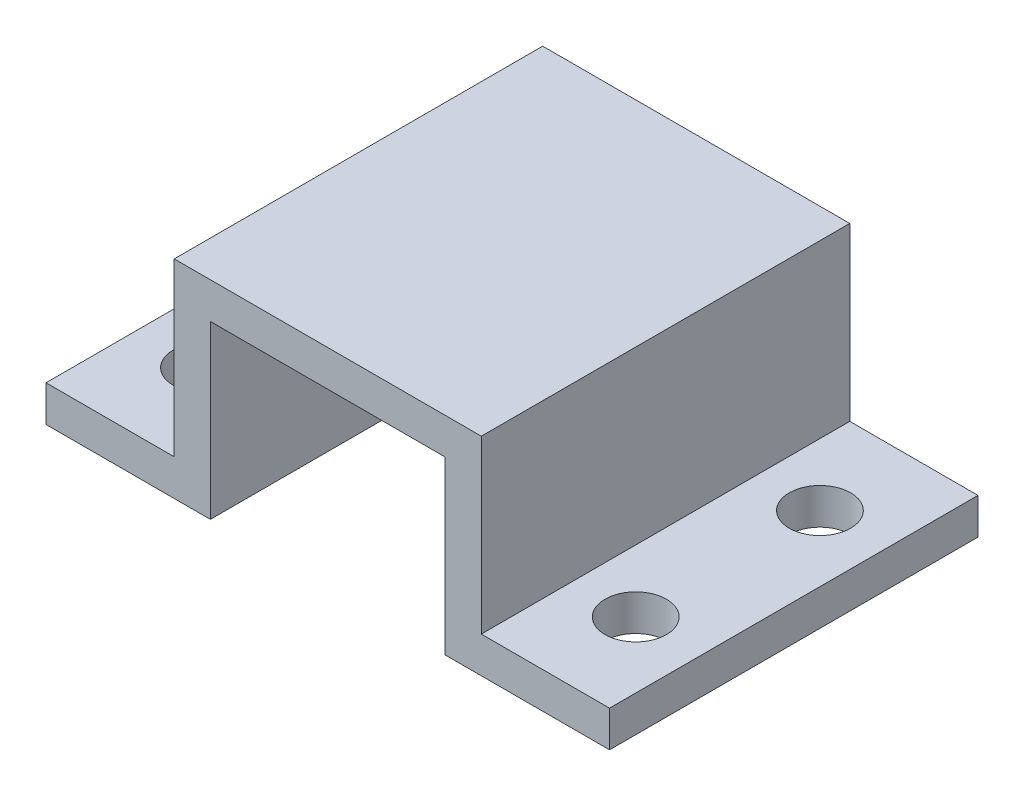
from build123d import *

# Parameters (mm, degrees)
SKETCH1_W             = 9.1
SKETCH1_H             = 20.4
SKETCH1_R             = 1.7
BOSS_EXTRUDE1_DEPTH   = 2
BOSS_EXTRUDE1_2_DEPTH = 2
SKETCH2_W             = 2
SKETCH2_H             = 20.4
BOSS_EXTRUDE2_DEPTH   = 9.49
SKETCH3_W             = 17
SKETCH3_H             = 20.4
BOSS_EXTRUDE3_DEPTH   = 2


with BuildPart() as part:
    # Sketch1 → Boss-Extrude1 (new body)
    with BuildSketch(Plane(origin=(0, 0, 0), x_dir=(1, 0, 0), z_dir=(0, 1, 0))):
        with Locations((-11.05, 0)):
            Rectangle(SKETCH1_W, SKETCH1_H)
        with Locations(Location((-11.95, -5.1, 0), (0, 0, 270))):
            Circle(SKETCH1_R, mode=Mode.SUBTRACT)
        with Locations(Location((-11.95, 5.1, 0), (0, 0, 270))):
            Circle(SKETCH1_R, mode=Mode.SUBTRACT)
    extrude(amount=BOSS_EXTRUDE1_DEPTH)



with BuildPart() as body_2:
    # Sketch1 → Boss-Extrude1 2 (new body)
    with BuildSketch(Plane(origin=(0, 0, 0), x_dir=(1, 0, 0), z_dir=(0, 1, 0))):
        with Locations((11.05, 0)):
            Rectangle(SKETCH1_W, SKETCH1_H)
        with Locations(Location((11.95, -5.1, 0), (0, 0, 270))):
            Circle(SKETCH1_R, mode=Mode.SUBTRACT)
        with Locations(Location((11.95, 5.1, 0), (0, 0, 270))):
            Circle(SKETCH1_R, mode=Mode.SUBTRACT)
    extrude(amount=BOSS_EXTRUDE1_2_DEPTH)


with BuildPart() as part_1:
    add(part.part)

    add(body_2.part)  # Boss-Extrude2 merges body 2
    # Sketch2 → Boss-Extrude2 (add)
    with BuildSketch(Plane(origin=(0, 0, 0), x_dir=(1, 0, 0), z_dir=(0, 1, 0))):
        with Locations((-7.5, 0)):
            Rectangle(SKETCH2_W, SKETCH2_H)
        with Locations((7.5, 0)):
            Rectangle(SKETCH2_W, SKETCH2_H)
    extrude(amount=BOSS_EXTRUDE2_DEPTH)

    # Sketch3 → Boss-Extrude3 (add)
    with BuildSketch(Plane(origin=(0, 9.49, 0), x_dir=(1, 0, 0), z_dir=(0, 1, 0))):
        Rectangle(SKETCH3_W, SKETCH3_H)
    extrude(amount=BOSS_EXTRUDE3_DEPTH)


solid = part_1.part
